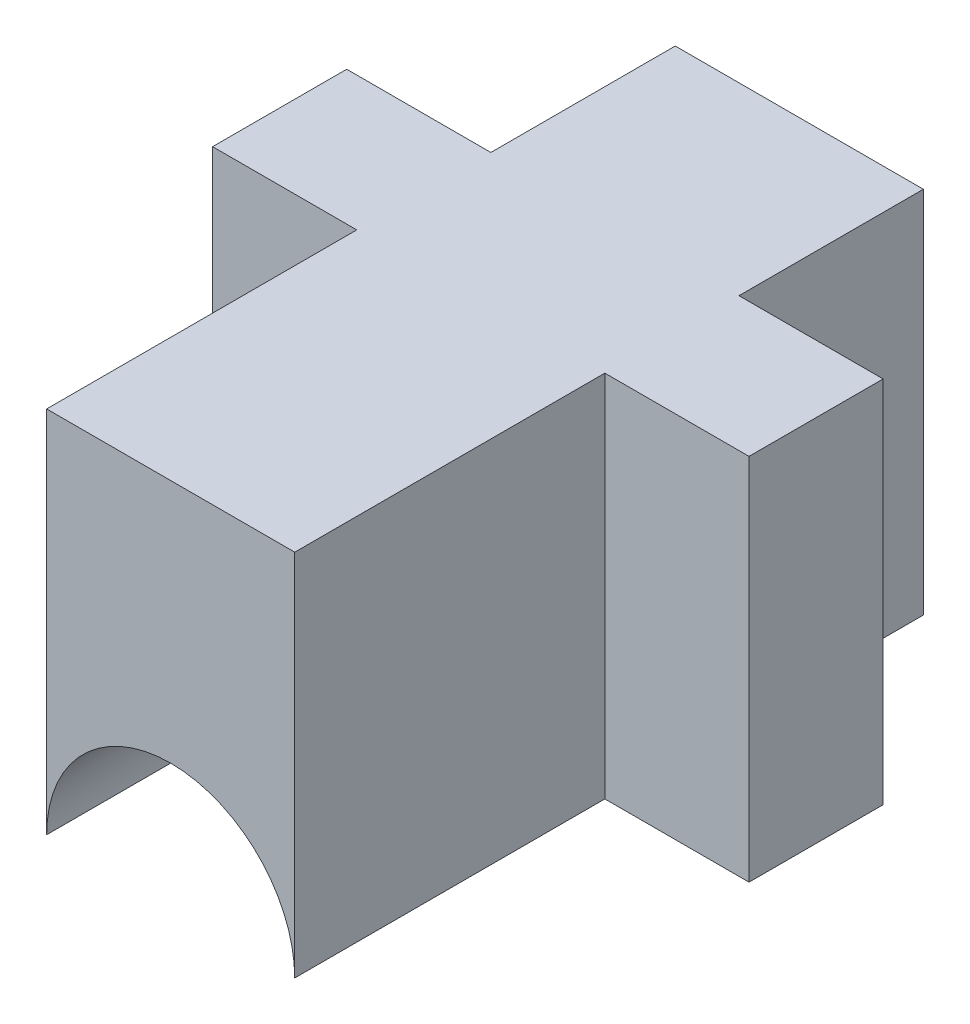
from build123d import *

# Parameters (mm, degrees)
BOSS_EXTRU_1_DEPTH      = 11
ENL_V_MAT_EXTRU_1_DEPTH = 31.697565104
ESQUISSE3_W             = 4.3
ESQUISSE3_H             = 0.5
ENL_V_MAT_EXTRU_2_DEPTH = 45.402774751


with BuildPart() as part:
    # Esquisse1 → Boss.-Extru.1 (new body)
    with BuildSketch(Plane(origin=(0, 0, 0), x_dir=(1, 0, 0), z_dir=(0, 1, 0))):
        Polygon((-17.374362812, 37.159499489), (-9.974362812, 37.159499489), (-9.974362812, 32.159499489), (-5.674362812, 32.159499489), (-5.674362812, 27.159499489), (-9.974362812, 27.159499489), (-9.974362812, 18.409499489), (-17.374362812, 18.409499489), (-17.374362812, 27.159499489), (-21.674362812, 27.159499489), (-21.674362812, 32.159499489), (-17.374362812, 32.159499489), align=None)
    extrude(amount=BOSS_EXTRU_1_DEPTH)

    # Esquisse2 → Enlèv. mat.-Extru.1 (cut, through all)
    with BuildSketch(Plane.XY.offset(-18.409499489)):
        with BuildLine():
            ThreePointArc((-9.974362812, 0), (-13.674362812, 3.7), (-17.374362812, 0))
            Line((-17.374362812, 0), (-9.974362812, 0))
        make_face()
        with BuildLine():
            Line((-9.974362812, 0), (-17.374362812, 0))
            ThreePointArc((-17.374362812, 0), (-13.674362812, -3.7), (-9.974362812, 0))
        make_face()
    extrude(amount=-ENL_V_MAT_EXTRU_1_DEPTH, mode=Mode.SUBTRACT)

    # Esquisse3 → Enlèv. mat.-Extru.2 (cut, through all)
    with BuildSketch(Plane(origin=(0, 11, 0), x_dir=(1, 0, 0), z_dir=(0, 1, 0))):
        with Locations((-7.824362812, 31.909499489)):
            Rectangle(ESQUISSE3_W, ESQUISSE3_H)
        with Locations((-19.524362812, 31.909499489)):
            Rectangle(ESQUISSE3_W, ESQUISSE3_H)
        with Locations((-19.524362812, 27.409499489)):
            Rectangle(ESQUISSE3_W, ESQUISSE3_H)
        with Locations((-7.824362812, 27.409499489)):
            Rectangle(ESQUISSE3_W, ESQUISSE3_H)
    extrude(amount=-ENL_V_MAT_EXTRU_2_DEPTH, mode=Mode.SUBTRACT)


solid = part.part
